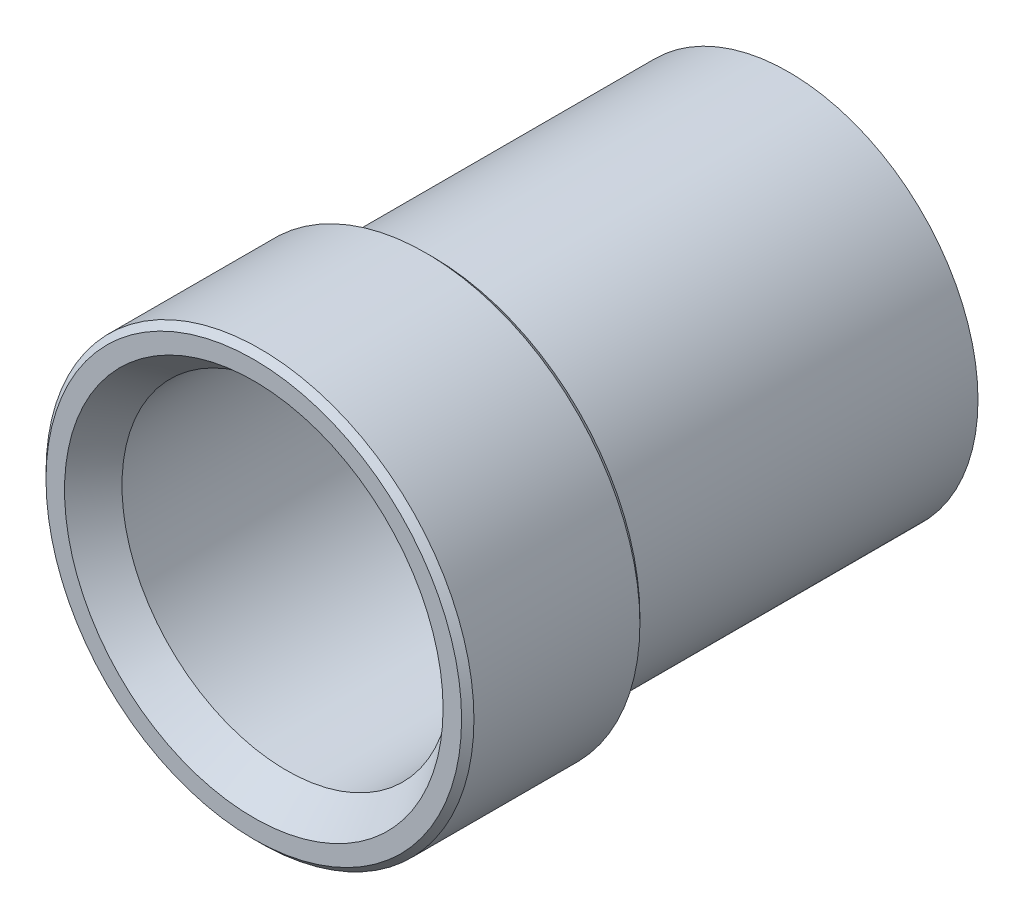
from build123d import *

# Parameters (mm, degrees)
CHAMFER1_SIZE = 0.1190625


with BuildPart() as part:
    # Sketch2 → Revolve1 (revolve)
    with BuildSketch(Plane(origin=(0, 0, 0), x_dir=(0, 0, -1), z_dir=(1, 0, 0)), mode=Mode.PRIVATE) as revolve1_sk:
        Polygon((-4.527369904, 3.175), (-5.159375, 3.65125), (-5.159375, 4.1275), (-1.719791667, 4.1275), (-1.719791667, 3.65125), (5.159375, 3.65125), (5.159375, 3.175), align=None)
    revolve(revolve1_sk.sketch.rotate(Axis((0, 0, 5.159375), (0, 0, -1)), 90), axis=Axis((0, 0, 5.159375), (0, 0, -1)))

    # Chamfer1
    chamfer1_edges = [part.edges().sort_by_distance(p)[0] for p in [
        (-4.1275, 0, 1.719791667),
        (-4.1275, 0, 5.159375),
    ]]
    chamfer(chamfer1_edges, length=CHAMFER1_SIZE)


solid = part.part
